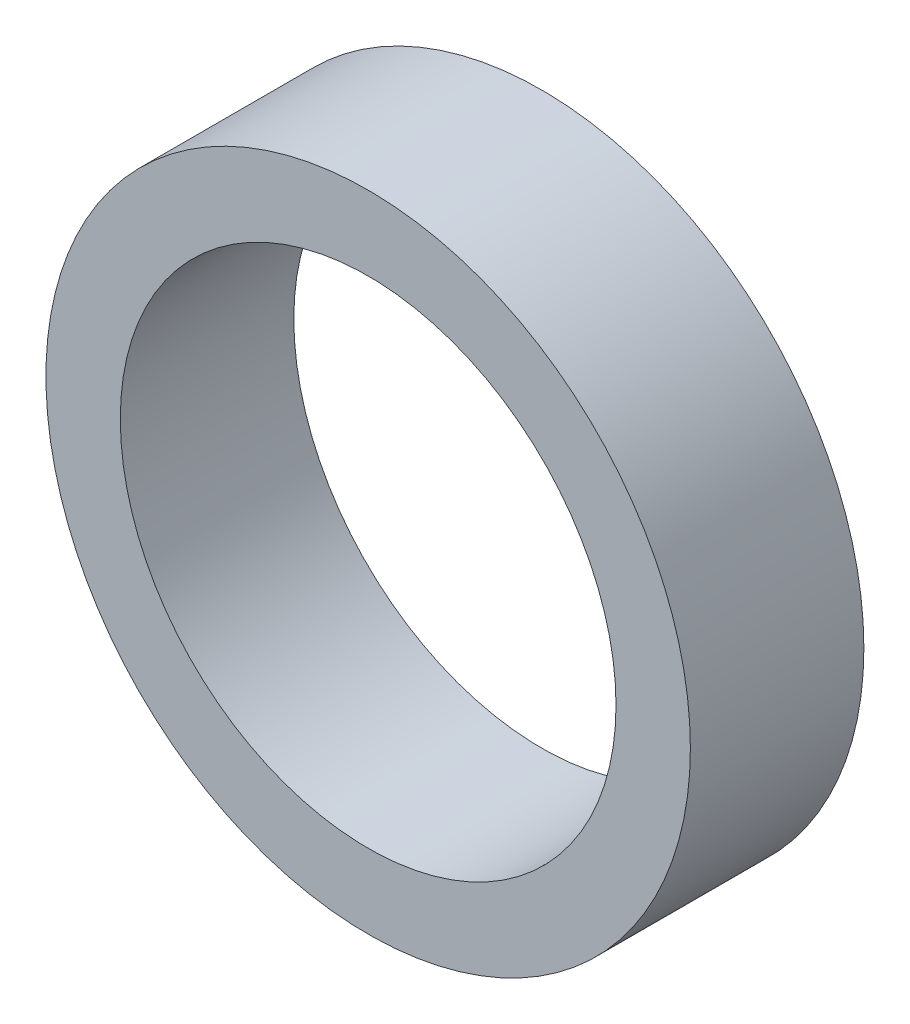
from build123d import *

# Parameters (mm, degrees)
SKETCH1_R           = 13
SKETCH1_R_2         = 10
BOSS_EXTRUDE1_DEPTH = 7


with BuildPart() as part:
    # Sketch1 → Boss-Extrude1 (new body)
    with BuildSketch(Plane.XY):
        Circle(SKETCH1_R)
        Circle(SKETCH1_R_2, mode=Mode.SUBTRACT)
    extrude(amount=BOSS_EXTRUDE1_DEPTH)


solid = part.part
